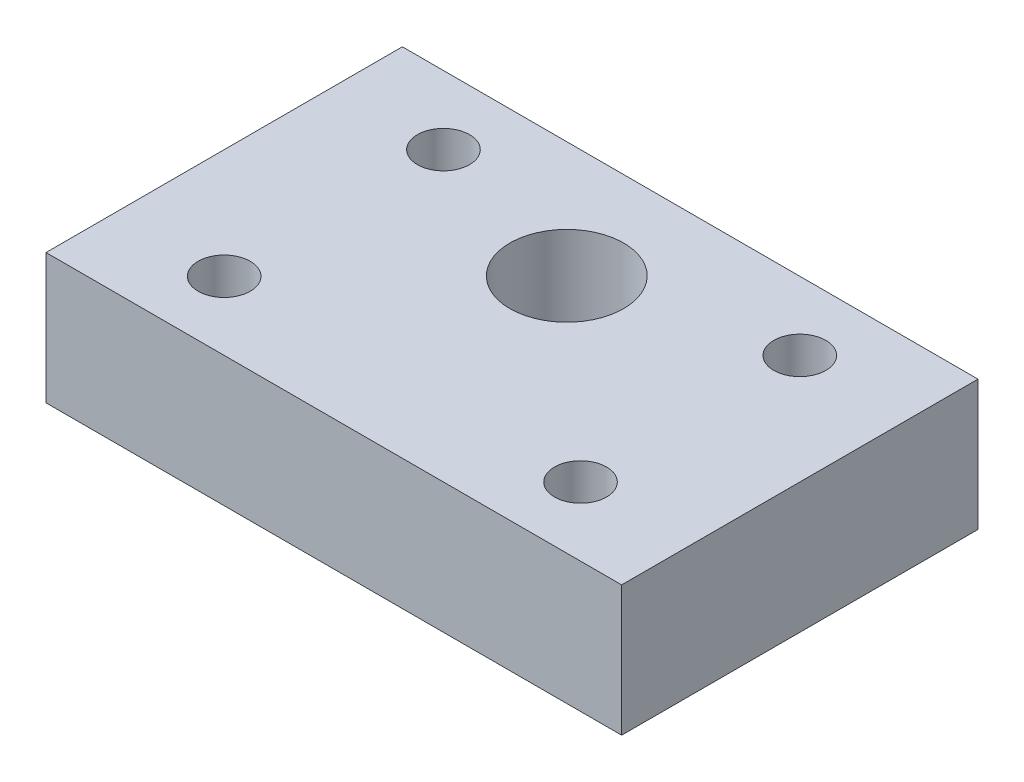
from build123d import *

# Parameters (mm, degrees)
SKETCH_1_W          = 42
SKETCH_1_H          = 26
EXTRUDE_1_DEPTH     = 9.5
SKETCH_3_R          = 4.15
CUT_EXTRUDE_1_DEPTH = 51.301590432
SKETCH_4_R          = 1.9
CUT_EXTRUDE_2_DEPTH = 51.301590432


with BuildPart() as part:
    # 草图1 → 凸台-拉伸1 (new body)
    with BuildSketch(Plane(origin=(0, 0, 0), x_dir=(1, 0, 0), z_dir=(0, 1, 0))):
        with Locations((21, -13)):
            Rectangle(SKETCH_1_W, SKETCH_1_H)
    extrude(amount=EXTRUDE_1_DEPTH)

    # 草图3 → 切除-拉伸1 (cut, through all)
    with BuildSketch(Plane(origin=(0, 9.5, 0), x_dir=(1, 0, 0), z_dir=(0, 1, 0))):
        with Locations(Location((20.47, -8.473805396, 0), (0, 0, 270))):
            Circle(SKETCH_3_R)
    extrude(amount=-CUT_EXTRUDE_1_DEPTH, mode=Mode.SUBTRACT)

    # 草图4 → 切除-拉伸2 (cut, through all)
    with BuildSketch(Plane(origin=(0, 9.5, 0), x_dir=(1, 0, 0), z_dir=(0, 1, 0))):
        with Locations(Location((8, -5, 0), (0, 0, 270))):
            Circle(SKETCH_4_R)
        with Locations(Location((8, -21, 0), (0, 0, 270))):
            Circle(SKETCH_4_R)
        with Locations(Location((34, -5, 0), (0, 0, 270))):
            Circle(SKETCH_4_R)
        with Locations(Location((34, -21, 0), (0, 0, 270))):
            Circle(SKETCH_4_R)
    extrude(amount=-CUT_EXTRUDE_2_DEPTH, mode=Mode.SUBTRACT)


solid = part.part
